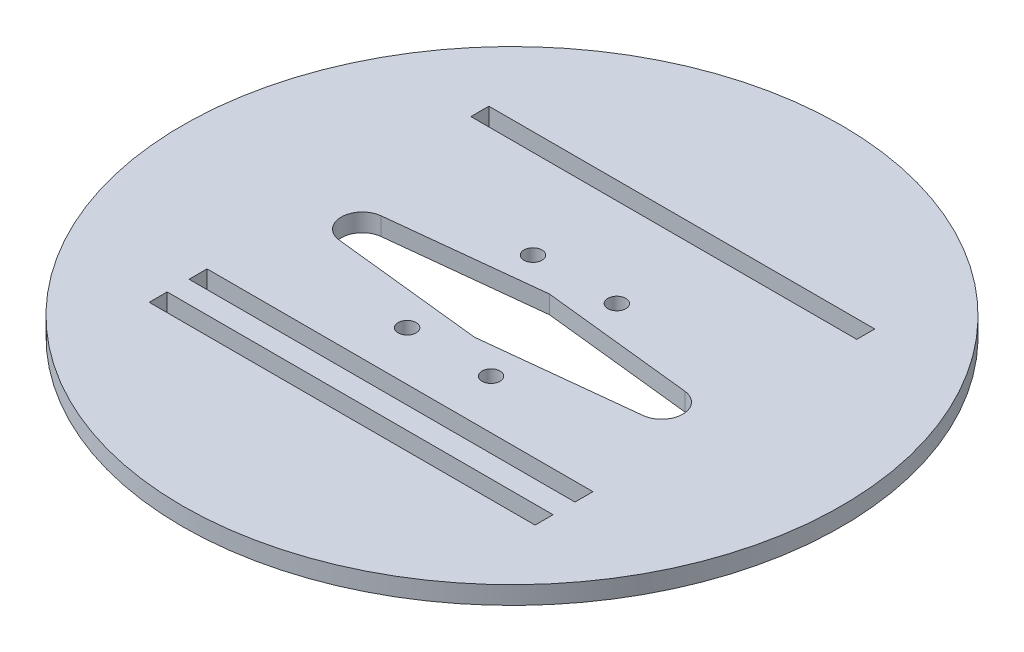
from build123d import *

# Parameters (mm, degrees)
SKETCH1_R           = 55
BOSS_EXTRUDE1_DEPTH = 3
CUT_EXTRUDE1_DEPTH  = 3
SKETCH4_R           = 1.5
SKETCH4_W           = 64.4
SKETCH4_H           = 3
CUT_EXTRUDE2_DEPTH  = 3


with BuildPart() as part:
    # Sketch1 → Boss-Extrude1 (new body)
    with BuildSketch(Plane(origin=(0, 0, 0), x_dir=(1, 0, 0), z_dir=(0, 1, 0))):
        with Locations(Location((0, 0, 0), (0, 0, 270))):
            Circle(SKETCH1_R)
    extrude(amount=BOSS_EXTRUDE1_DEPTH)

    # Sketch3 → Cut-Extrude1 (cut)
    with BuildSketch(Plane(origin=(0, 3, 0), x_dir=(1, 0, 0), z_dir=(0, 1, 0))):
        with BuildLine():
            Line((-25.359029713, 3.5), (0, 6.25))
            Line((0, 6.25), (25.359029713, 3.5))
            ThreePointArc((25.359029713, 3.5), (28.5, 0), (25.359029713, -3.5))
            Line((25.359029713, -3.5), (0, -6.25))
            Line((0, -6.25), (-25.359029713, -3.5))
            ThreePointArc((-25.359029713, -3.5), (-28.5, 0), (-25.359029713, 3.5))
        make_face()
    extrude(amount=-CUT_EXTRUDE1_DEPTH, mode=Mode.SUBTRACT)

    # Sketch4 → Cut-Extrude2 (cut)
    with BuildSketch(Plane(origin=(0, 3, 0), x_dir=(1, 0, 0), z_dir=(0, 1, 0))):
        with Locations(Location((-7, -10.5, 0), (0, 0, 270))):
            Circle(SKETCH4_R)
        with Locations(Location((7, -10.5, 0), (0, 0, 270))):
            Circle(SKETCH4_R)
        with Locations(Location((-7, 10.5, 0), (0, 0, 270))):
            Circle(SKETCH4_R)
        with Locations(Location((7, 10.5, 0), (0, 0, 270))):
            Circle(SKETCH4_R)
        with Locations((0, -20.19)):
            Rectangle(SKETCH4_W, SKETCH4_H)
        with Locations((0, -26.85)):
            Rectangle(SKETCH4_W, SKETCH4_H)
        with Locations((0, 26.84)):
            Rectangle(SKETCH4_W, SKETCH4_H)
    extrude(amount=-CUT_EXTRUDE2_DEPTH, mode=Mode.SUBTRACT)


solid = part.part
